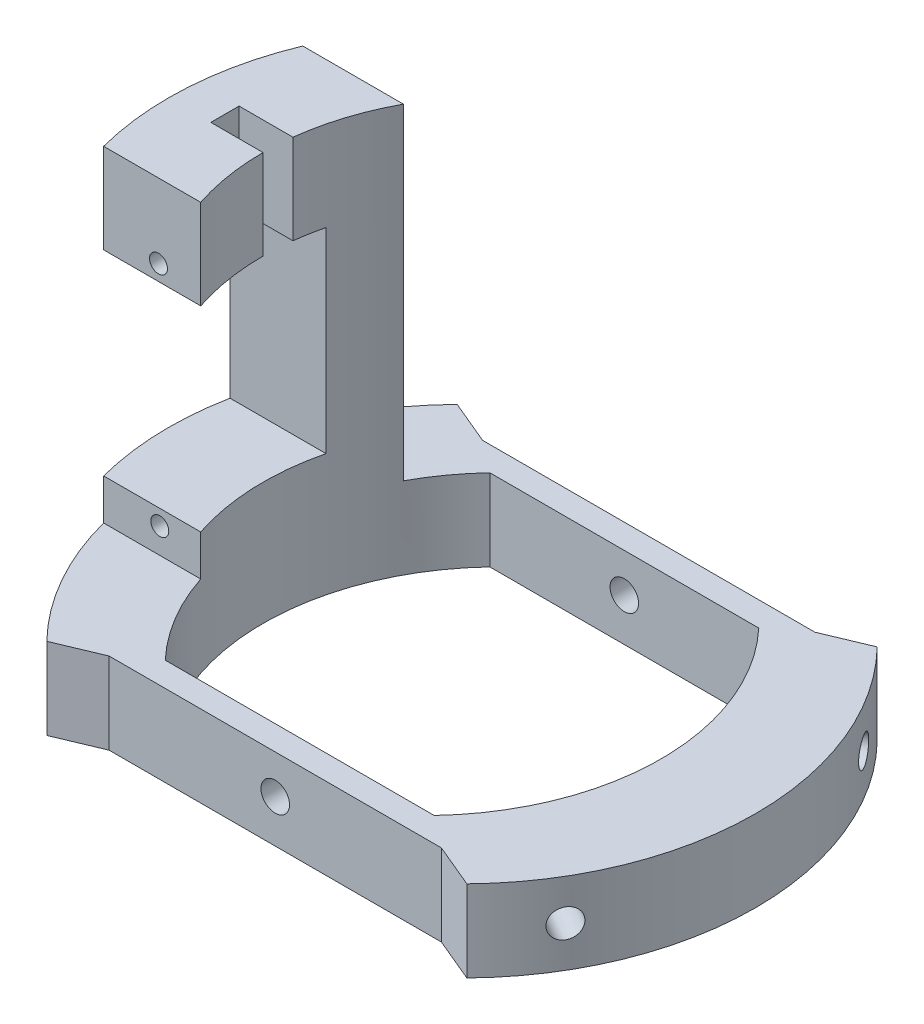
from build123d import *
from build123d.topology import SkipClean

# Parameters (mm, degrees)
BOSS_EXTRUDE1_DEPTH = 10
BOSS_EXTRUDE3_DEPTH = 50
SKETCH3_W           = 18.659519989
SKETCH3_H           = 24
CUT_EXTRUDE2_DEPTH  = 16
SKETCH4_W           = 7.007010428
SKETCH4_H           = 3.464986189
CUT_EXTRUDE4_DEPTH  = 11
SKETCH6_R           = 1.75
CUT_EXTRUDE5_DEPTH  = 50
SKETCH7_R           = 1.1
CUT_EXTRUDE6_DEPTH  = 10
SKETCH8_R           = 1.1
CUT_EXTRUDE7_DEPTH  = 10
SKETCH12_R          = 1.75
CUT_EXTRUDE11_DEPTH = 6
SKETCH13_R          = 1.75
CUT_EXTRUDE12_DEPTH = 6
CUT_EXTRUDE13_START = -6
SKETCH15_R          = 1.75
CUT_EXTRUDE13_DEPTH = 6
CUT_EXTRUDE14_START = -6
SKETCH16_R          = 1.75
CUT_EXTRUDE14_DEPTH = 6


with BuildPart() as part:
    # Sketch1 → Boss-Extrude1 (new body)
    with BuildSketch(Plane(origin=(0, 0, 0), x_dir=(1, 0, 0), z_dir=(0, 1, 0))):
        with BuildLine():
            Line((-20.369908508, -22.9), (20.369908508, -22.9))
            Line((20.369908508, -22.9), (25.75194079, -25.156262551))
            ThreePointArc((25.75194079, -25.156262551), (36, 0), (25.75194079, 25.156262551))
            Line((25.75194079, 25.156262551), (20.369908508, 22.9))
            Line((20.369908508, 22.9), (-20.369908508, 22.9))
            Line((-20.369908508, 22.9), (-25.75194079, 25.156262551))
            ThreePointArc((-25.75194079, 25.156262551), (-30.058427692, 19.811383714), (-33.272198921, 13.746300555))
            Line((-33.272198921, 13.746300555), (-20.930426703, 13.746300555))
            ThreePointArc((-20.930426703, 13.746300555), (-18.911500586, 16.969147591), (-16.488091862, 19.9))
            Line((-16.488091862, 19.9), (16.488091862, 19.9))
            ThreePointArc((16.488091862, 19.9), (24.396538405, 0), (16.488091862, -19.9))
            Line((16.488091862, -19.9), (-16.488091862, -19.9))
            ThreePointArc((-16.488091862, -19.9), (-20.300121646, -14.857351831), (-22.928570874, -9.108340935))
            Line((-22.928570874, -9.108340935), (-34.828696866, -9.108340935))
            ThreePointArc((-34.828696866, -9.108340935), (-31.335081965, -17.723223133), (-25.75194079, -25.156262551))
            Line((-25.75194079, -25.156262551), (-20.369908508, -22.9))
        make_face()
    extrude(amount=BOSS_EXTRUDE1_DEPTH)

    # Sketch1<5> → Boss-Extrude3 (add)
    with BuildSketch(Plane(origin=(0, 0, 0), x_dir=(1, 0, 0), z_dir=(0, 1, 0))):
        with BuildLine():
            ThreePointArc((-33.272198921, 13.746300555), (-35.916801934, 2.44608643), (-34.828696866, -9.108340935))
            Line((-34.828696866, -9.108340935), (-22.928570874, -9.108340935))
            ThreePointArc((-22.928570874, -9.108340935), (-24.286368586, 2.525037107), (-20.930426703, 13.746300555))
            Line((-20.930426703, 13.746300555), (-33.272198921, 13.746300555))
        make_face()
    extrude(amount=BOSS_EXTRUDE3_DEPTH)

    # Sketch3 → Cut-Extrude2 (cut)
    with BuildSketch(Plane.XY.offset(9.108340935)):
        with Locations((-32.258330869, 27)):
            Rectangle(SKETCH3_W, SKETCH3_H)
    extrude(amount=-CUT_EXTRUDE2_DEPTH, mode=Mode.SUBTRACT)

    # Sketch4 → Cut-Extrude4 (cut)
    with BuildSketch(Plane(origin=(0, 50, 0), x_dir=(1, 0, 0), z_dir=(0, 1, 0))):
        with Locations((-27.295412644, 1.732493095)):
            Rectangle(SKETCH4_W, SKETCH4_H)
    extrude(amount=-CUT_EXTRUDE4_DEPTH, mode=Mode.SUBTRACT)

    # Sketch6 → Cut-Extrude5 (cut)
    with BuildSketch(Plane(origin=(0, 0, -22.9), x_dir=(-1, 0, 0), z_dir=(0, 0, -1))):
        with Locations((0, 5.25)):
            Circle(SKETCH6_R)
    extrude(amount=-CUT_EXTRUDE5_DEPTH, mode=Mode.SUBTRACT)

    # Sketch7 → Cut-Extrude6 (cut)
    with BuildSketch(Plane.XY.offset(9.108340935)):
        with Locations((-28.103908, 40.912886193)):
            Circle(SKETCH7_R)
    extrude(amount=-CUT_EXTRUDE6_DEPTH, mode=Mode.SUBTRACT)

    # Sketch8 → Cut-Extrude7 (cut)
    with BuildSketch(Plane.XY.offset(9.108340935)):
        with Locations((-27.944858765, 13.113341173)):
            Circle(SKETCH8_R)
    extrude(amount=-CUT_EXTRUDE7_DEPTH, mode=Mode.SUBTRACT)

    # Sketch12 → Cut-Extrude11 (cut)
    with BuildSketch(Plane(origin=(30.999475006, 10, 18.303894377), x_dir=(0.5084415104778145, 0, -0.8610965279357702), z_dir=(0.8610965279357702, 0, 0.5084415104778145))):
        with Locations((0, -5)):
            Circle(SKETCH12_R)
    extrude(amount=-CUT_EXTRUDE11_DEPTH, mode=Mode.SUBTRACT)

    # Sketch13 → Cut-Extrude12 (cut)
    with BuildSketch(Plane(origin=(30.999475006, 10, -18.303894377), x_dir=(-0.5084415104778145, 0, -0.8610965279357701), z_dir=(0.8610965279357701, 0, -0.5084415104778145))):
        with Locations((0, -5)):
            Circle(SKETCH13_R)
    extrude(amount=-CUT_EXTRUDE12_DEPTH, mode=Mode.SUBTRACT)

    # Sketch15 → Cut-Extrude13 (cut)
    with SkipClean():  # the faces are left unmerged after this step: merging them gives an invalid solid
        with BuildSketch(Plane(origin=(-30.999475006, 10, 18.303894377), x_dir=(0.5084415104778142, 0, 0.8610965279357703), z_dir=(-0.8610965279357703, 0, 0.5084415104778142)).offset(CUT_EXTRUDE13_START)):
            with Locations((0, -5)):
                Circle(SKETCH15_R)
        extrude(amount=CUT_EXTRUDE13_DEPTH, mode=Mode.SUBTRACT)

    # Sketch16 → Cut-Extrude14 (cut)
    with SkipClean():  # the faces are left unmerged after this step: merging them gives an invalid solid
        with BuildSketch(Plane(origin=(-30.999475006, 10, -18.303894377), x_dir=(-0.508441510477814, 0, 0.8610965279357704), z_dir=(-0.8610965279357704, 0, -0.508441510477814)).offset(CUT_EXTRUDE14_START)):
            with Locations((0, -5)):
                Circle(SKETCH16_R)
        extrude(amount=CUT_EXTRUDE14_DEPTH, mode=Mode.SUBTRACT)


solid = part.part
